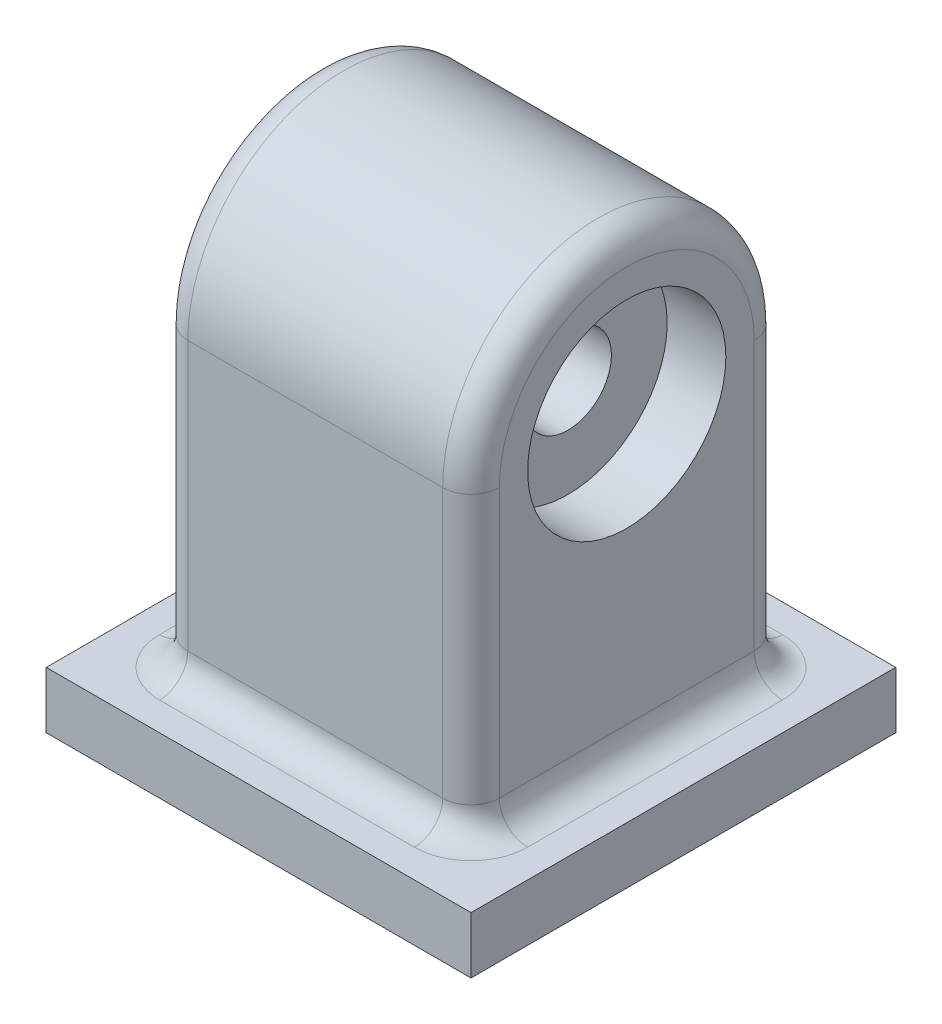
from build123d import *

# Parameters (mm, degrees)
SKETCH1_W                                   = 190.5
SKETCH1_H                                   = 190.5
SKETCH1_R                                   = 9.525
BOSS_EXTRUDE1_DEPTH                         = 25.4
SKETCH1_3_R                                 = 9.525
BOSS_EXTRUDE2_DEPTH                         = 25.4
SKETCH3_W                                   = 139.7
SKETCH3_H                                   = 139.7
BOSS_EXTRUDE3_DEPTH                         = 203.2
FILLET1_RADIUS                              = 69.85
FILLET1_LENGTH                              = 139.7
CBORE_FOR_1_1_2_HEAVY_HEX_BOLT1_D           = 38.89248
CBORE_FOR_1_1_2_HEAVY_HEX_BOLT1_CBORE_D     = 88.9
CBORE_FOR_1_1_2_HEAVY_HEX_BOLT1_CBORE_DEPTH = 26.3144
FILLET2_R                                   = 12.7


with BuildPart() as part:
    # Sketch1 → Boss-Extrude1 (new body)
    # profile 1 of 5: a face of its own
    with BuildSketch(Plane(origin=(0, 0, 0), x_dir=(1, 0, 0), z_dir=(0, 1, 0))):
        Rectangle(SKETCH1_W, SKETCH1_H)
        with Locations((-57.15, -57.15)):
            Circle(SKETCH1_R, mode=Mode.SUBTRACT)
        with Locations((57.15, -57.15)):
            Circle(SKETCH1_R, mode=Mode.SUBTRACT)
        with Locations((57.15, 57.15)):
            Circle(SKETCH1_R, mode=Mode.SUBTRACT)
        with Locations((-57.15, 57.15)):
            Circle(SKETCH1_R, mode=Mode.SUBTRACT)
    # profile 2 of 5: a face of its own
    with BuildSketch(Plane(origin=(0, 0, 0), x_dir=(1, 0, 0), z_dir=(0, 1, 0))):
        with Locations((-57.15, -57.15)):
            Circle(SKETCH1_R)
    # profile 3 of 5: a face of its own
    with BuildSketch(Plane(origin=(0, 0, 0), x_dir=(1, 0, 0), z_dir=(0, 1, 0))):
        with Locations((-57.15, 57.15)):
            Circle(SKETCH1_R)
    # profile 4 of 5: a face of its own
    with BuildSketch(Plane(origin=(0, 0, 0), x_dir=(1, 0, 0), z_dir=(0, 1, 0))):
        with Locations((57.15, 57.15)):
            Circle(SKETCH1_R)
    # profile 5 of 5: a face of its own
    with BuildSketch(Plane(origin=(0, 0, 0), x_dir=(1, 0, 0), z_dir=(0, 1, 0))):
        with Locations((57.15, -57.15)):
            Circle(SKETCH1_R)
    extrude(amount=BOSS_EXTRUDE1_DEPTH)

    # Sketch1<3> → Boss-Extrude2 (add)
    with BuildSketch(Plane(origin=(0, 0, 0), x_dir=(1, 0, 0), z_dir=(0, 1, 0))):
        with Locations(Location((-57.15, 57.15, 0), (0, 0, 270))):
            Circle(SKETCH1_3_R)
        with Locations(Location((57.15, 57.15, 0), (0, 0, 270))):
            Circle(SKETCH1_3_R)
        with Locations(Location((57.15, -57.15, 0), (0, 0, 270))):
            Circle(SKETCH1_3_R)
        with Locations(Location((-57.15, -57.15, 0), (0, 0, 270))):
            Circle(SKETCH1_3_R)
    extrude(amount=-BOSS_EXTRUDE2_DEPTH)

    # Sketch3 → Boss-Extrude3 (add)
    with BuildSketch(Plane(origin=(0, 25.4, 0), x_dir=(1, 0, 0), z_dir=(0, 1, 0))):
        Rectangle(SKETCH3_W, SKETCH3_H)
    extrude(amount=BOSS_EXTRUDE3_DEPTH)

    # Fillet1: full round fillet: the end face becomes a half cylinder, R = half its width
    fillet1_face = Plane((0, 228.6, 0), x_dir=(-1, 0, 0), z_dir=(0, 1, 0))  # on the end face: x along it, z out of the body
    fillet1_slab = fillet1_face.offset(-FILLET1_RADIUS / 2) * Box(FILLET1_LENGTH, 2 * FILLET1_RADIUS, FILLET1_RADIUS, mode=Mode.PRIVATE)  # the body's end, R deep
    fillet1_round = Plane((0, 158.75, 0), x_dir=(0, 1, 0), z_dir=(-1, 0, 0)) * Cylinder(FILLET1_RADIUS, FILLET1_LENGTH, mode=Mode.PRIVATE)  # its axis R under the face
    add(fillet1_slab - fillet1_round, mode=Mode.SUBTRACT)

    # CBORE for 1-1/2 Heavy Hex Bolt1 (through all)
    with Locations(Plane(origin=(69.85, 0, 0), x_dir=(0, 0, 1), z_dir=(1, 0, 0))):
        with Locations((0, -158.75)):
            CounterBoreHole(CBORE_FOR_1_1_2_HEAVY_HEX_BOLT1_D / 2, CBORE_FOR_1_1_2_HEAVY_HEX_BOLT1_CBORE_D / 2, CBORE_FOR_1_1_2_HEAVY_HEX_BOLT1_CBORE_DEPTH)

    # Fillet2
    fillet2_edges = [part.edges().sort_by_distance(p)[0] for p in [
        (0, 25.4, -69.85),
        (-69.85, 25.4, 0),
        (0, 25.4, 69.85),
        (69.85, 25.4, 0),
        (69.85, 92.075, 69.85),
        (-69.85, 92.075, 69.85),
        (-69.85, 92.075, -69.85),
        (69.85, 92.075, -69.85),
        (69.85, 228.6, 0),
        (-69.85, 228.6, 0),
    ]]
    fillet(fillet2_edges, radius=FILLET2_R)


solid = part.part
